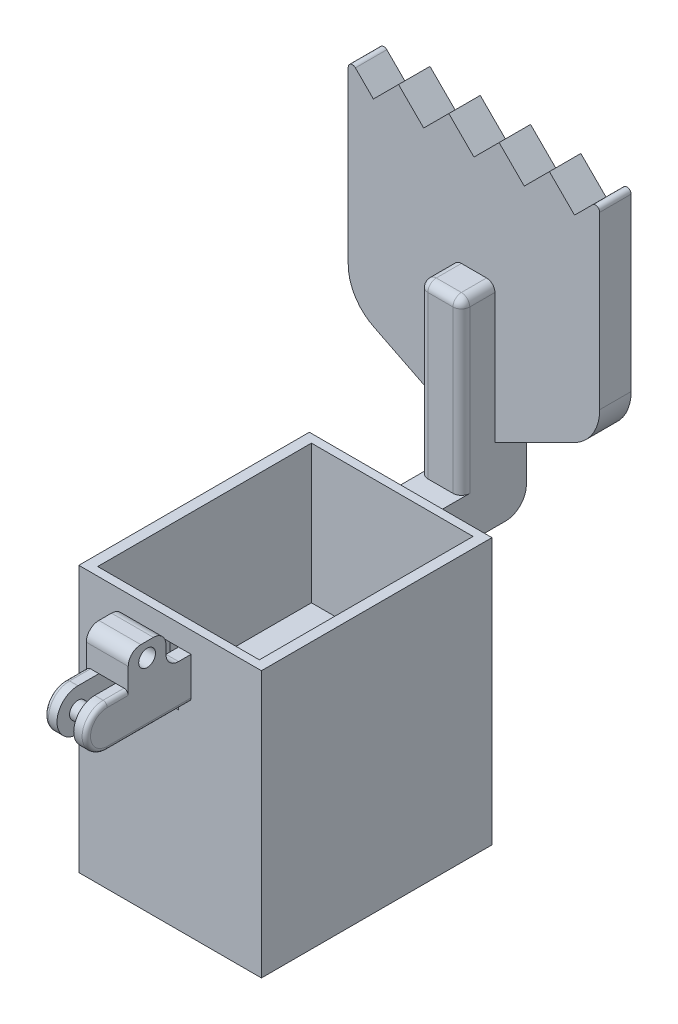
from build123d import *

# Parameters (mm, degrees)
SKETCH1_W           = 43.57
SKETCH1_H           = 63.5
BOSS_EXTRUDE1_DEPTH = 55
CUT_EXTRUDE2_DEPTH  = 95.634004988
SKETCH4_W           = 43.57
SKETCH4_H           = 55
SKETCH4_W_2         = 6
SKETCH4_H_2         = 15
BOSS_EXTRUDE2_DEPTH = 9
SKETCH5_R           = 1
CUT_EXTRUDE3_DEPTH  = 1
BOSS_EXTRUDE3_START = -26.785
BOSS_EXTRUDE3_DEPTH = 10
SKETCH7_R           = 2
CUT_EXTRUDE4_DEPTH  = 2
SKETCH13_W          = 9
SKETCH13_H          = 8
BOSS_EXTRUDE6_DEPTH = 10
FILLET12_R          = 3
FILLET2_R           = 1
BOSS_EXTRUDE4_DEPTH = 10
BOSS_EXTRUDE5_DEPTH = 7.5
CUT_EXTRUDE11_DEPTH = 174.835946297
LPATTERN1_COUNT     = 5
LPATTERN1_PITCH     = 12
FILLET9_R           = 1
FILLET11_R          = 11
SKETCH14_R          = 2
CUT_EXTRUDE12_DEPTH = 156.361674811
SKETCH15_W          = 15
SKETCH15_H          = 33
CUT_EXTRUDE13_DEPTH = 33
SKETCH16_W          = 15
SKETCH16_H          = 25
CUT_EXTRUDE14_DEPTH = 26
SKETCH18_R          = 1.016
CUT_EXTRUDE15_DEPTH = 8
SKETCH19_W          = 15
SKETCH19_H          = 5
CUT_EXTRUDE16_DEPTH = 25
SKETCH20_W          = 38.57
SKETCH20_H          = 51
CUT_EXTRUDE17_DEPTH = 33
SKETCH21_W          = 4
SKETCH21_H          = 13
CUT_EXTRUDE18_DEPTH = 27
SKETCH22_W          = 10
SKETCH22_H          = 40.521468164
BOSS_EXTRUDE7_DEPTH = 8
FILLET13_R          = 2
FILLET14_R          = 2


with BuildPart() as part:
    # Sketch1 → Boss-Extrude1 (new body)
    with BuildSketch(Plane.XY):
        with Locations((21.785, 31.75)):
            Rectangle(SKETCH1_W, SKETCH1_H)
    extrude(amount=BOSS_EXTRUDE1_DEPTH)

    # Sketch3 → Cut-Extrude2 (cut, through all)
    with BuildSketch(Plane(origin=(43.57, 0, 0), x_dir=(0, 0, -1), z_dir=(1, 0, 0))):
        with BuildLine():
            Line((-29.5, 0), (-29.5, 1.5))
            ThreePointArc((-29.5, 1.5), (-29.060660172, 2.560660172), (-28, 3))
            Line((-28, 3), (-27, 3))
            ThreePointArc((-27, 3), (-25.939339828, 2.560660172), (-25.5, 1.5))
            Line((-25.5, 1.5), (-25.5, 0))
            Line((-25.5, 0), (-22.5, 0))
            Line((-22.5, 0), (-22.5, 3.5))
            ThreePointArc((-22.5, 3.5), (-22.939339828, 4.560660172), (-24, 5))
            Line((-24, 5), (-31, 5))
            ThreePointArc((-31, 5), (-32.060660172, 4.560660172), (-32.5, 3.5))
            Line((-32.5, 3.5), (-32.5, 0))
            Line((-32.5, 0), (-29.5, 0))
        make_face()
    extrude(amount=-CUT_EXTRUDE2_DEPTH, mode=Mode.SUBTRACT)


with BuildPart() as cut_extrude2_piece_1:
    # of the separate pieces the step leaves, piece 1, a body of its own (cut_extrude2_pieces)
    add(part.part.solids().sort_by_distance((0, 0, 0))[0])



with BuildPart() as cut_extrude2_piece_2:
    # of the separate pieces the step leaves, piece 2, a body of its own (cut_extrude2_pieces)
    add(part.part.solids().sort_by_distance((43.57, 0, 25.5))[0])


with BuildPart() as cut_extrude2_piece_1_1:
    add(cut_extrude2_piece_1.part)

    add(cut_extrude2_piece_2.part)  # Boss-Extrude2 merges Cut-Extrude2 piece 2
    # Sketch4 → Boss-Extrude2 (add)
    with BuildSketch(Plane.XZ):
        with Locations((21.785, 27.5)):
            Rectangle(SKETCH4_W, SKETCH4_H)
        with Locations((10.785, 27.5)):
            Rectangle(SKETCH4_W_2, SKETCH4_H_2, mode=Mode.SUBTRACT)
        with Locations((32.785, 27.5)):
            Rectangle(SKETCH4_W_2, SKETCH4_H_2, mode=Mode.SUBTRACT)
    extrude(amount=-BOSS_EXTRUDE2_DEPTH)

    # Sketch5 → Cut-Extrude3 (cut)
    with BuildSketch(Plane(origin=(0, 0, 0), x_dir=(-1, 0, 0), z_dir=(0, -1, 0))):
        with Locations(Location((-21.785, -27.5, 0), (0, 0, 90))):
            Circle(SKETCH5_R)
    extrude(amount=-CUT_EXTRUDE3_DEPTH, mode=Mode.SUBTRACT)

    # Sketch6 → Boss-Extrude3 (add)
    with BuildSketch(Plane.ZY.offset(BOSS_EXTRUDE3_START)):
        with BuildLine():
            Line((55, 48.5), (75, 48.5))
            ThreePointArc((75, 48.5), (80, 53.5), (75, 58.5))
            Line((75, 58.5), (55, 58.5))
            ThreePointArc((55, 58.5), (50, 53.5), (55, 48.5))
        make_face()
    boss_extrude3 = extrude(amount=BOSS_EXTRUDE3_DEPTH)

    # Mirror1: Boss-Extrude3 across plane
    add(boss_extrude3.mirror(Plane(origin=(0, 0, 27.5), x_dir=(1, 0, 0), z_dir=(0, 0, -1))))

    # Sketch7 → Cut-Extrude4 (cut, symmetric)
    # profile 1 of 3: a face of its own
    with BuildSketch(Plane.ZY.offset(-21.785)):
        with BuildLine():
            ThreePointArc((75, 58.5), (71.464466094, 57.035533906), (70, 53.5))
            ThreePointArc((70, 53.5), (71.464466094, 49.964466094), (75, 48.5))
            ThreePointArc((75, 48.5), (78.535533906, 49.964466094), (80, 53.5))
            ThreePointArc((80, 53.5), (78.535533906, 57.035533906), (75, 58.5))
        make_face()
        with Locations(Location((75, 53.5, 0), (0, 0, 270))):
            Circle(SKETCH7_R, mode=Mode.SUBTRACT)
    # profile 2 of 3: a face of its own
    with BuildSketch(Plane.ZY.offset(-21.785)):
        with BuildLine():
            Line((70, 58.5), (70, 53.5))
            ThreePointArc((70, 53.5), (71.464466094, 57.035533906), (75, 58.5))
            Line((75, 58.5), (70, 58.5))
        make_face()
    # profile 3 of 3: a face of its own
    with BuildSketch(Plane.ZY.offset(-21.785)):
        with BuildLine():
            ThreePointArc((75, 48.5), (71.464466094, 49.964466094), (70, 53.5))
            Line((70, 53.5), (70, 48.5))
            Line((70, 48.5), (75, 48.5))
        make_face()
    extrude(amount=CUT_EXTRUDE4_DEPTH, both=True, mode=Mode.SUBTRACT)

    # Sketch13 → Boss-Extrude6 (add)
    with BuildSketch(Plane(origin=(26.785, 0, 0), x_dir=(0, 0, -1), z_dir=(1, 0, 0))):
        with Locations((-65.5, 62.5)):
            Rectangle(SKETCH13_W, SKETCH13_H)
    extrude(amount=-BOSS_EXTRUDE6_DEPTH)

    # Fillet12
    fillet12_edges = [cut_extrude2_piece_1_1.edges().sort_by_distance(p)[0] for p in [
        (21.785, 66.5, 61),
        (21.785, 66.5, 70),
        (21.785, 58.5, 61),
    ]]
    fillet(fillet12_edges, radius=FILLET12_R)

    # Fillet2
    fillet2_edges = [cut_extrude2_piece_1_1.edges().sort_by_distance(p)[0] for p in [
        (16.785, 48.5, 65),
        (16.785, 53.5, 80),
        (16.785, 58.5, 72.5),
        (26.785, 48.5, 65),
        (26.785, 53.5, 80),
        (26.785, 58.5, 72.5),
    ]]
    fillet(fillet2_edges, radius=FILLET2_R)

    # Sketch10 → Boss-Extrude4 (add)
    with BuildSketch(Plane.ZY.offset(-16.785)):
        with BuildLine():
            Line((-25, 53.5), (-25, 78.5))
            Line((-25, 78.5), (-17.5, 78.5))
            Line((-17.5, 78.5), (-17.5, 58.5))
            Line((-17.5, 58.5), (-20, 58.5))
            ThreePointArc((-20, 58.5), (-23.535533906, 57.035533906), (-25, 53.5))
        make_face()
    extrude(amount=-BOSS_EXTRUDE4_DEPTH)

    # Sketch11 → Boss-Extrude5 (add)
    with BuildSketch(Plane(origin=(0, 0, -25), x_dir=(-1, 0, 0), z_dir=(0, 0, -1))):
        Polygon((-21.785, 63.5), (8.215, 78.5), (8.215, 128.5), (-51.785, 128.5), (-51.785, 78.5), align=None)
    extrude(amount=-BOSS_EXTRUDE5_DEPTH)

    # Sketch12 → Cut-Extrude11 (cut, through all)
    with BuildSketch(Plane(origin=(0, 0, -25), x_dir=(-1, 0, 0), z_dir=(0, 0, -1))):
        Polygon((-51.785, 128.5), (-45.785, 122.5), (-39.785, 128.5), align=None)
    cut_extrude11 = extrude(amount=-CUT_EXTRUDE11_DEPTH, mode=Mode.SUBTRACT)

    # LPattern1: Cut-Extrude11 ×5
    with Locations(*[(-i * LPATTERN1_PITCH, 0, 0) for i in range(1, LPATTERN1_COUNT)]):
        add(cut_extrude11, mode=Mode.SUBTRACT)

    # Fillet9
    fillet9_edges = [cut_extrude2_piece_1_1.edges().sort_by_distance(p)[0] for p in [
        (-8.215, 128.5, -21.25),
        (51.785, 128.5, -21.25),
    ]]
    fillet(fillet9_edges, radius=FILLET9_R)

    # Fillet11
    fillet11_edges = [cut_extrude2_piece_1_1.edges().sort_by_distance(p)[0] for p in [
        (-8.215, 78.5, -21.25),
        (51.785, 78.5, -21.25),
    ]]
    fillet(fillet11_edges, radius=FILLET11_R)

    # Sketch14 → Cut-Extrude12 (cut, through all)
    with BuildSketch(Plane.ZY.offset(-16.785)):
        with Locations(Location((65.5, 63, 0), (0, 0, 270))):
            Circle(SKETCH14_R)
    extrude(amount=-CUT_EXTRUDE12_DEPTH, mode=Mode.SUBTRACT)

    # Sketch15 → Cut-Extrude13 (cut)
    with BuildSketch(Plane(origin=(0, 63.5, 0), x_dir=(1, 0, 0), z_dir=(0, 1, 0))):
        with Locations((21.785, -27.5)):
            Rectangle(SKETCH15_W, SKETCH15_H)
    extrude(amount=-CUT_EXTRUDE13_DEPTH, mode=Mode.SUBTRACT)

    # Sketch16 → Cut-Extrude14 (cut)
    with BuildSketch(Plane(origin=(0, 30.5, 0), x_dir=(1, 0, 0), z_dir=(0, 1, 0))):
        with Locations((21.785, -27.5)):
            Rectangle(SKETCH16_W, SKETCH16_H)
    extrude(amount=-CUT_EXTRUDE14_DEPTH, mode=Mode.SUBTRACT)

    # Sketch18 → Cut-Extrude15 (cut)
    with BuildSketch(Plane(origin=(0, 30.5, 0), x_dir=(1, 0, 0), z_dir=(0, 1, 0))):
        with Locations(Location((21.785, -13.6, 0), (0, 0, 270))):
            Circle(SKETCH18_R)
        with Locations(Location((21.785, -41.4, 0), (0, 0, 270))):
            Circle(SKETCH18_R)
    extrude(amount=-CUT_EXTRUDE15_DEPTH, mode=Mode.SUBTRACT)

    # Sketch19 → Cut-Extrude16 (cut)
    with BuildSketch(Plane(origin=(0, 4.5, 0), x_dir=(1, 0, 0), z_dir=(0, 1, 0))):
        with Locations((21.785, -17.5)):
            Rectangle(SKETCH19_W, SKETCH19_H)
    extrude(amount=-CUT_EXTRUDE16_DEPTH, mode=Mode.SUBTRACT)

    # Sketch20 → Cut-Extrude17 (cut)
    with BuildSketch(Plane(origin=(0, 63.5, 0), x_dir=(1, 0, 0), z_dir=(0, 1, 0))):
        with Locations((21.785, -27.5)):
            Rectangle(SKETCH20_W, SKETCH20_H)
    extrude(amount=-CUT_EXTRUDE17_DEPTH, mode=Mode.SUBTRACT)

    # Sketch21 → Cut-Extrude18 (cut)
    with BuildSketch(Plane.XY.offset(70)):
        with Locations((21.785, 52)):
            Rectangle(SKETCH21_W, SKETCH21_H)
    extrude(amount=-CUT_EXTRUDE18_DEPTH, mode=Mode.SUBTRACT)

    # Sketch22 → Boss-Extrude7 (add)
    with BuildSketch(Plane.XY.offset(-17.5)):
        with Locations((21.785, 78.760734082)):
            Rectangle(SKETCH22_W, SKETCH22_H)
    extrude(amount=BOSS_EXTRUDE7_DEPTH)

    # Fillet13
    fillet13_edges = [cut_extrude2_piece_1_1.edges().sort_by_distance(p)[0] for p in [
        (16.785, 99.021468164, -13.5),
        (26.785, 99.021468164, -13.5),
    ]]
    fillet(fillet13_edges, radius=FILLET13_R)

    # Fillet14
    fillet14_edges = [cut_extrude2_piece_1_1.edges().sort_by_distance(p)[0] for p in [
        (26.785, 77.760734082, -9.5),
        (21.785, 99.021468164, -9.5),
        (16.785, 77.760734082, -9.5),
        (17.370786438, 98.435681727, -9.5),
        (26.199213562, 98.435681727, -9.5),
    ]]
    fillet(fillet14_edges, radius=FILLET14_R)


solid = cut_extrude2_piece_1_1.part
